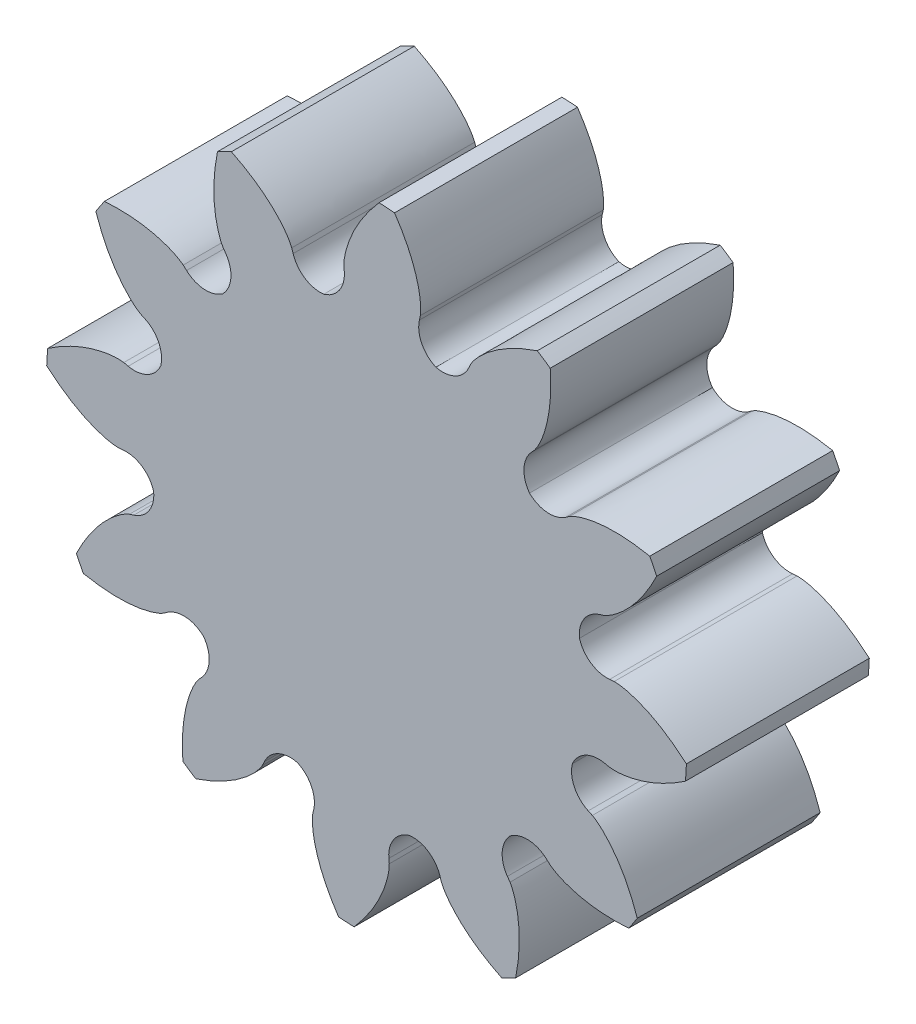
from build123d import *

# Parameters (mm, degrees)
SKETCH1_R           = 7.540625
BOSS_EXTRUDE1_DEPTH = 6.35
BOSS_EXTRUDE2_START = -6.35
BOSS_EXTRUDE2_DEPTH = 6.35
CIRPATTERN1_COUNT   = 12


with BuildPart() as part:
    # Sketch1 → Boss-Extrude1 (new body)
    with BuildSketch(Plane.XY):
        Circle(SKETCH1_R)
    extrude(amount=BOSS_EXTRUDE1_DEPTH)

    # Sketch2 → Boss-Extrude2 (add)
    with BuildSketch(Plane.XY.offset(6.35).offset(BOSS_EXTRUDE2_START)):
        with BuildLine():
            ThreePointArc((2.408682376, 7.145577276), (1.918658971, 7.606631761), (1.833740268, 8.274076882))
            Line((1.833740268, 8.274076882), (1.867871498, 8.428081478))
            add(Edge.make_bspline(
                [(1.867871498, 8.428081478), (1.890027, 8.589642819), (1.874125743, 8.904843151), (1.802963997, 9.264708669), (1.59380668, 10.019577882), (1.295108843, 10.591204175), (0.97244699, 11.069869155)],
                knots=[0, 0, 0, 0, 0.17205105, 0.330899491, 0.387189732, 1, 1, 1, 1], degree=3))
            ThreePointArc((0.97244699, 11.069869155), (0.703237725, 11.09022601), (0.433613377, 11.10403691))
            add(Edge.make_bspline(
                [(-0.788332001, 8.596512897), (-0.789902704, 8.75957873), (-0.734314822, 9.070245894), (-0.61826726, 9.41824036), (-0.315435205, 10.140644028), (0.053074174, 10.669962321), (0.433613377, 11.10403691)],
                knots=[0, 0, 0, 0, 0.17205105, 0.330899491, 0.387189732, 1, 1, 1, 1], degree=3))
            Line((-0.788332001, 8.596512897), (-0.773926973, 8.439430589))
            ThreePointArc((-0.773926973, 8.439430589), (-0.942472693, 7.788057795), (-1.48680851, 7.392592633))
            ThreePointArc((-1.48680851, 7.392592633), (0.477197028, 7.525510507), (2.408682376, 7.145577276))
        make_face()
    boss_extrude2 = extrude(amount=BOSS_EXTRUDE2_DEPTH)

    # CirPattern1: Boss-Extrude2 ×12 about axis
    cirpattern1_axis = Axis((0, 0, 6.35), (0, 0, -1))
    for i in range(1, CIRPATTERN1_COUNT):
        add(boss_extrude2.rotate(cirpattern1_axis, i * 360 / CIRPATTERN1_COUNT))


solid = part.part
